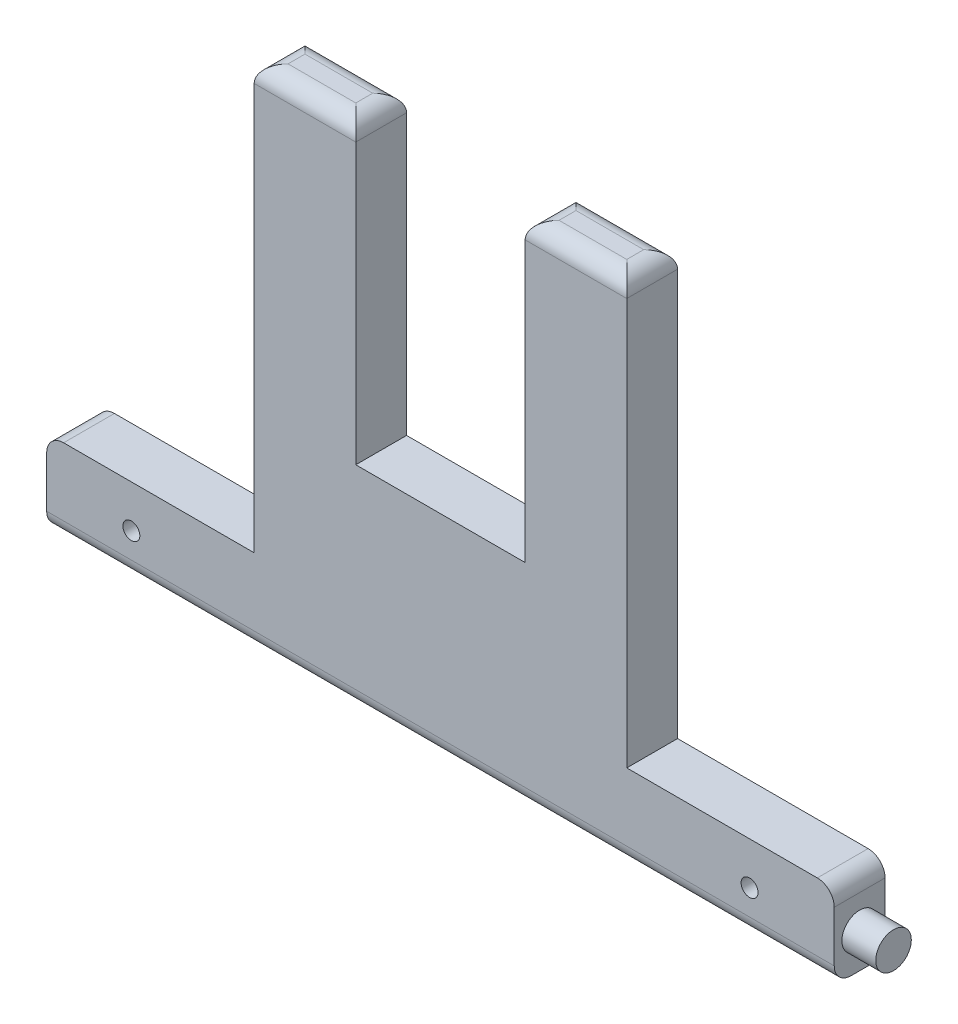
from build123d import *

# Parameters (mm, degrees)
SKETCH1_R           = 1.27
BOSS_EXTRUDE1_DEPTH = 7.62
FILLET1_R           = 2.54
FILLET2_R           = 2.54
FILLET3_R           = 2.54
SKETCH4_R           = 2.667
BOSS_EXTRUDE2_DEPTH = 5.08
SKETCH5_W           = 3.683
SKETCH5_H           = 5.461
CUT_EXTRUDE2_DEPTH  = 8.89


with BuildPart() as part:
    # Sketch1 → Boss-Extrude1 (new body)
    with BuildSketch(Plane.XY):
        Polygon((-55.174879418, -67.47023925), (-55.174879418, -54.77023925), (-24.059879418, -54.77023925), (-24.059879418, 8.72976075), (-8.819879418, 8.72976075), (-8.819879418, -35.72023925), (16.580120582, -35.72023925), (16.580120582, 8.72976075), (31.820120582, 8.72976075), (31.820120582, -54.77023925), (62.935120582, -54.77023925), (62.935120582, -67.47023925), align=None)
        with Locations(Location((-42.474879418, -61.12023925, 0), (0, 0, 180))):
            Circle(SKETCH1_R, mode=Mode.SUBTRACT)
        with Locations(Location((50.235120582, -61.12023925, 0), (0, 0, 180))):
            Circle(SKETCH1_R, mode=Mode.SUBTRACT)
    extrude(amount=BOSS_EXTRUDE1_DEPTH)

    # Fillet1
    fillet1_edges = [part.edges().sort_by_distance(p)[0] for p in [
        (-16.439879418, 8.72976075, 0),
        (24.200120582, 8.72976075, 0),
        (24.200120582, 8.72976075, 7.62),
        (-24.059879418, 8.72976075, 3.81),
        (-8.819879418, 8.72976075, 3.81),
        (16.580120582, 8.72976075, 3.81),
        (31.820120582, 8.72976075, 3.81),
        (-16.439879418, 8.72976075, 7.62),
    ]]
    fillet(fillet1_edges, radius=FILLET1_R)

    # Fillet2
    fillet2_edges = [part.edges().sort_by_distance(p)[0] for p in [
        (3.880120582, -67.47023925, 0),
        (3.880120582, -67.47023925, 7.62),
    ]]
    fillet(fillet2_edges, radius=FILLET2_R)

    # Fillet3
    fillet3_edges = [part.edges().sort_by_distance(p)[0] for p in [
        (-55.174879418, -54.77023925, 3.81),
        (62.935120582, -54.77023925, 3.81),
    ]]
    fillet(fillet3_edges, radius=FILLET3_R)

    # Sketch4 → Boss-Extrude2 (add)
    with BuildSketch(Plane(origin=(62.935120582, 0, 0), x_dir=(0, 0, -1), z_dir=(1, 0, 0))):
        with Locations(Location((-3.81, -62.250449816, 0), (0, 0, 180))):
            Circle(SKETCH4_R)
    extrude(amount=BOSS_EXTRUDE2_DEPTH)

    # Sketch5 → Cut-Extrude2 (cut)
    with BuildSketch(Plane.ZY.offset(55.174879418)):
        with Locations((3.769019213, -62.653923663)):
            Rectangle(SKETCH5_W, SKETCH5_H)
    extrude(amount=-CUT_EXTRUDE2_DEPTH, mode=Mode.SUBTRACT)


solid = part.part
